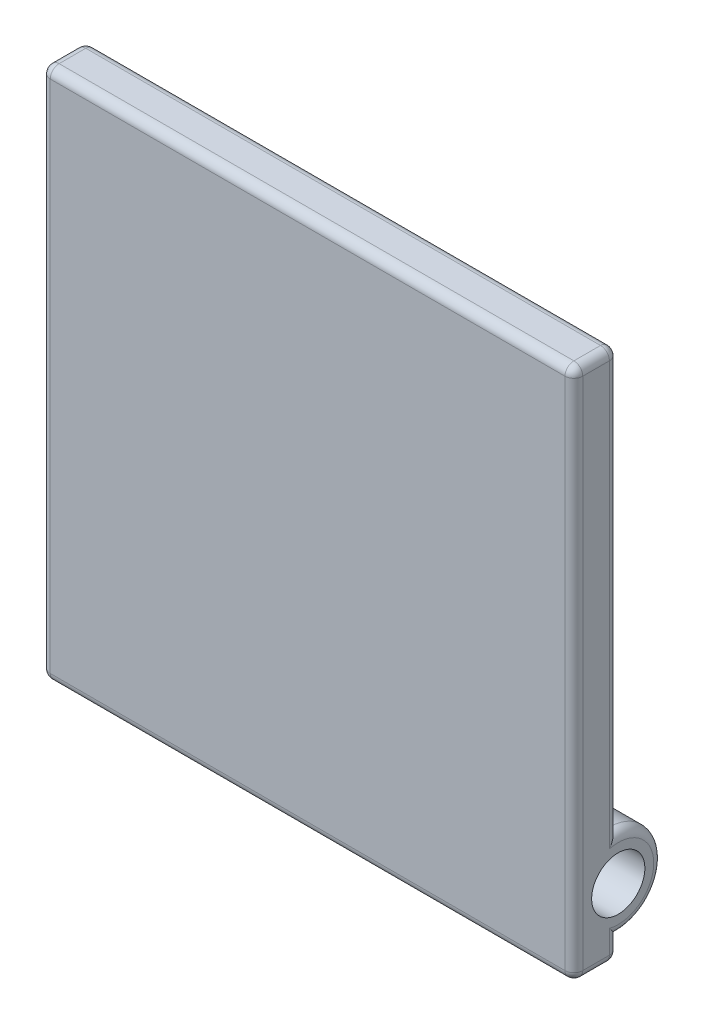
from build123d import *

# Parameters (mm, degrees)
SKETCH1_W           = 152.4
SKETCH1_H           = 152.4
BOSS_EXTRUDE1_DEPTH = 12.7
BOSS_EXTRUDE2_DEPTH = 12.7
SKETCH2_R           = 7.62
CUT_EXTRUDE1_DEPTH  = 12.7
FILLET1_R           = 2.54
FILLET2_R           = 2.54


with BuildPart() as part:
    # Sketch1 → Boss-Extrude1 (new body)
    with BuildSketch(Plane.XY):
        Rectangle(SKETCH1_W, SKETCH1_H)
    extrude(amount=BOSS_EXTRUDE1_DEPTH)

    # Sketch3 → Boss-Extrude2 (add)
    with BuildSketch(Plane.ZY.offset(76.2)):
        with BuildLine():
            Line((0, -69.85), (0, -44.45))
            ThreePointArc((0, -44.45), (-12.7, -57.15), (0, -69.85))
        make_face()
    boss_extrude2 = extrude(amount=-BOSS_EXTRUDE2_DEPTH)

    # Sketch2 → Cut-Extrude1 (cut)
    with BuildSketch(Plane.ZY.offset(76.2)):
        with Locations((0, -57.15)):
            Circle(SKETCH2_R)
    cut_extrude1 = extrude(amount=-CUT_EXTRUDE1_DEPTH, mode=Mode.SUBTRACT)

    # Mirror1: Boss-Extrude2, Cut-Extrude1 across plane
    add(boss_extrude2.mirror(Plane(origin=(0, 0, 0), x_dir=(0, 0, 1), z_dir=(1, 0, 0))))
    add(cut_extrude1.mirror(Plane(origin=(0, 0, 0), x_dir=(0, 0, 1), z_dir=(1, 0, 0))), mode=Mode.SUBTRACT)

    # Fillet1
    fillet1_edges = [part.edges().sort_by_distance(p)[0] for p in [
        (0, -76.2, 12.7),
    ]]
    fillet(fillet1_edges, radius=FILLET1_R)

    # Fillet2
    fillet2_edges = [part.edges().sort_by_distance(p)[0] for p in [
        (-76.2, 15.875, 0),
        (-76.2, -57.15, -12.7),
        (-63.5, -57.15, -12.7),
        (76.2, 15.875, 0),
        (63.5, -57.15, -12.7),
        (76.2, -57.15, -12.7),
        (-76.2, 1.27, 12.7),
        (76.2, 1.27, 12.7),
        (76.2, -76.2, 5.08),
        (76.2, -75.456051224, 11.956051224),
        (0, -76.2, 0),
        (-76.2, -76.2, 5.08),
        (-76.2, -75.456051224, 11.956051224),
        (76.2, -73.025, 0),
        (0, 76.2, 0),
        (-76.2, -73.025, 0),
        (0, 76.2, 12.7),
        (76.2, 76.2, 6.35),
        (-76.2, 76.2, 6.35),
    ]]
    fillet(fillet2_edges, radius=FILLET2_R)


solid = part.part
